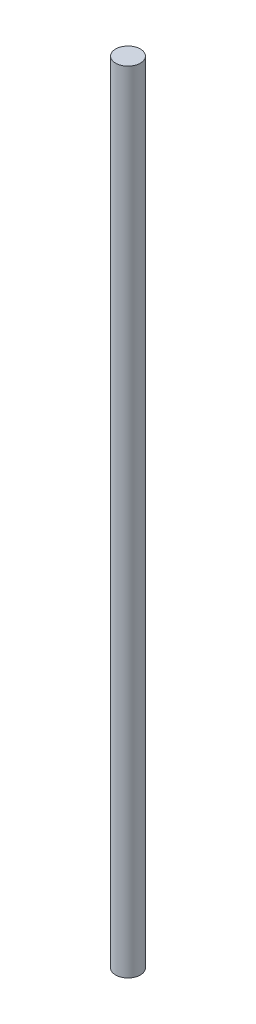
from build123d import *

# Parameters (mm, degrees)
SKETCH1_R           = 0.5
BOSS_EXTRUDE1_DEPTH = 32


with BuildPart() as part:
    # Sketch1 → Boss-Extrude1 (new body)
    with BuildSketch(Plane(origin=(0, 0, 0), x_dir=(1, 0, 0), z_dir=(0, 1, 0))):
        with Locations(Location((0, 0, 0), (0, 0, 270))):
            Circle(SKETCH1_R)
    extrude(amount=BOSS_EXTRUDE1_DEPTH)


solid = part.part
